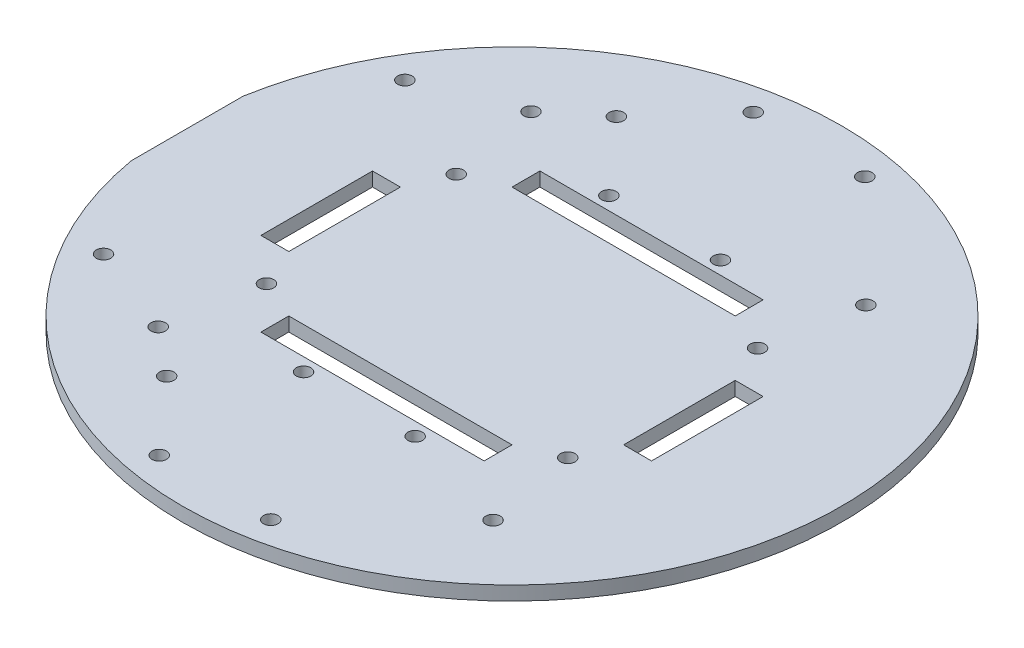
from build123d import *

# Parameters (mm, degrees)
SKETCH1_R           = 1.651
SKETCH1_W           = 50.8
SKETCH1_H           = 6.35
SKETCH1_W_2         = 6.35
SKETCH1_H_2         = 25.4
BOSS_EXTRUDE1_DEPTH = 3.175


with BuildPart() as part:
    # Sketch1 → Boss-Extrude1 (new body)
    with BuildSketch(Plane(origin=(0, 0, 0), x_dir=(1, 0, 0), z_dir=(0, 1, 0))):
        with BuildLine():
            Line((-73.916912814, 12.7), (-73.916912814, -12.7))
            ThreePointArc((-73.916912814, -12.7), (75, 0), (-73.916912814, 12.7))
        make_face()
        with Locations(Location((-34.29, 21.59, 0), (0, 0, 270))):
            Circle(SKETCH1_R, mode=Mode.SUBTRACT)
        with Locations(Location((34.29, 21.59, 0), (0, 0, 270))):
            Circle(SKETCH1_R, mode=Mode.SUBTRACT)
        with Locations(Location((-34.29, -21.59, 0), (0, 0, 270))):
            Circle(SKETCH1_R, mode=Mode.SUBTRACT)
        with Locations(Location((34.29, -21.59, 0), (0, 0, 270))):
            Circle(SKETCH1_R, mode=Mode.SUBTRACT)
        with Locations(Location((38.1, -42.418, 0), (0, 0, 270))):
            Circle(SKETCH1_R, mode=Mode.SUBTRACT)
        with Locations(Location((-38.1, -42.418, 0), (0, 0, 270))):
            Circle(SKETCH1_R, mode=Mode.SUBTRACT)
        with Locations(Location((-58.676912814, -34.29, 0), (0, 0, 270))):
            Circle(SKETCH1_R, mode=Mode.SUBTRACT)
        with Locations(Location((-58.676912814, 34.29, 0), (0, 0, 270))):
            Circle(SKETCH1_R, mode=Mode.SUBTRACT)
        with Locations(Location((-38.1, 42.418, 0), (0, 0, 270))):
            Circle(SKETCH1_R, mode=Mode.SUBTRACT)
        with Locations(Location((38.1, 42.418, 0), (0, 0, 270))):
            Circle(SKETCH1_R, mode=Mode.SUBTRACT)
        with Locations(Location((12.7, -67.593386492, 0), (0, 0, 90))):
            Circle(SKETCH1_R, mode=Mode.SUBTRACT)
        with Locations(Location((12.7, -34.743386492, 0), (0, 0, 90))):
            Circle(SKETCH1_R, mode=Mode.SUBTRACT)
        with Locations(Location((12.7, 34.743386492, 0), (0, 0, 270))):
            Circle(SKETCH1_R, mode=Mode.SUBTRACT)
        with Locations(Location((12.7, 67.593386492, 0), (0, 0, 270))):
            Circle(SKETCH1_R, mode=Mode.SUBTRACT)
        with Locations(Location((-27.425, -51.168386492, 0), (0, 0, 270))):
            Circle(SKETCH1_R, mode=Mode.SUBTRACT)
        with Locations(Location((-12.7, -34.743386492, 0), (0, 0, 270))):
            Circle(SKETCH1_R, mode=Mode.SUBTRACT)
        with Locations(Location((-12.7, -67.593386492, 0), (0, 0, 270))):
            Circle(SKETCH1_R, mode=Mode.SUBTRACT)
        with Locations(Location((-12.7, 67.593386492, 0), (0, 0, 90))):
            Circle(SKETCH1_R, mode=Mode.SUBTRACT)
        with Locations(Location((-27.425, 51.168386492, 0), (0, 0, 90))):
            Circle(SKETCH1_R, mode=Mode.SUBTRACT)
        with Locations(Location((-12.7, 34.743386492, 0), (0, 0, 90))):
            Circle(SKETCH1_R, mode=Mode.SUBTRACT)
        with Locations((0, 28.575)):
            Rectangle(SKETCH1_W, SKETCH1_H, mode=Mode.SUBTRACT)
        with Locations((41.275, 0)):
            Rectangle(SKETCH1_W_2, SKETCH1_H_2, mode=Mode.SUBTRACT)
        with Locations((0, -28.575)):
            Rectangle(SKETCH1_W, SKETCH1_H, mode=Mode.SUBTRACT)
        with Locations((-41.275, 0)):
            Rectangle(SKETCH1_W_2, SKETCH1_H_2, mode=Mode.SUBTRACT)
    extrude(amount=BOSS_EXTRUDE1_DEPTH)


solid = part.part
